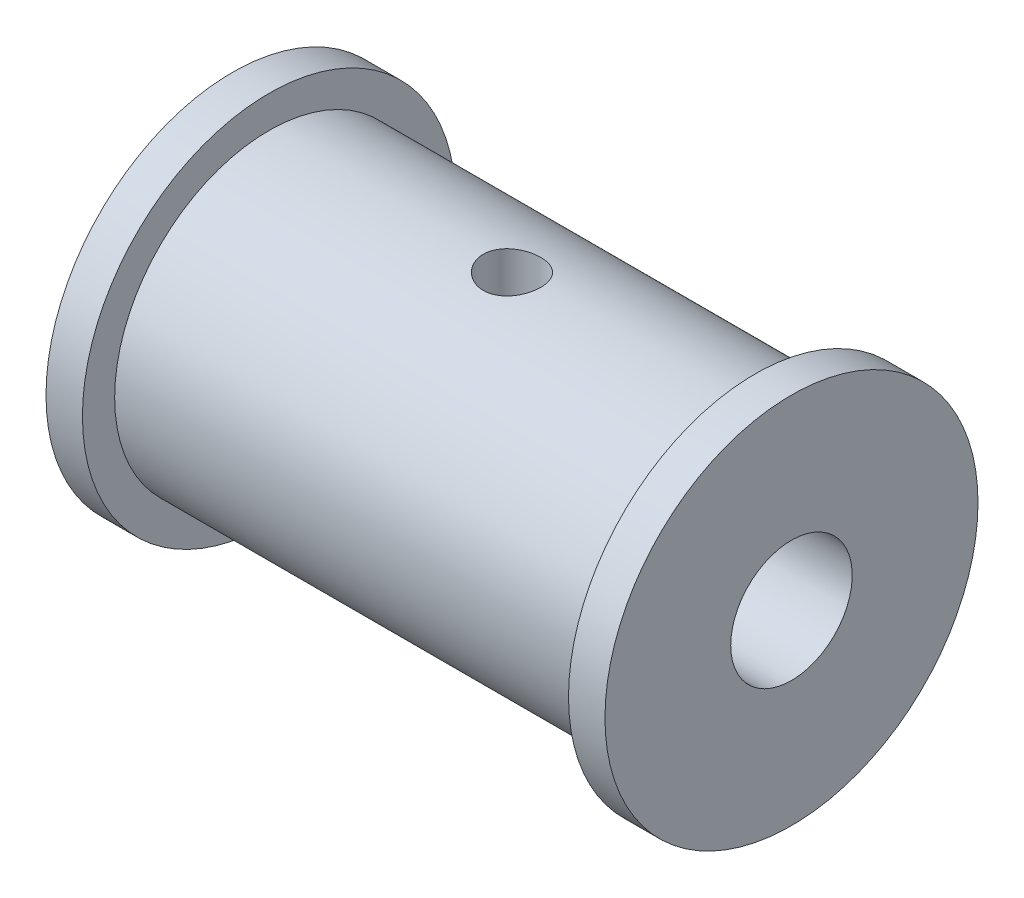
from build123d import *

# Parameters (mm, degrees)
SKETCH2_R          = 1.5
CUT_EXTRUDE1_DEPTH = 21.082922848


with BuildPart() as part:
    # Sketch1 → Revolve1 (revolve)
    with BuildSketch(Plane.XY):
        Polygon((14.605, 3.175), (14.605, 9.74725), (12.7, 9.74725), (12.7, 8.0645), (-12.7, 8.0645), (-12.7, 9.74725), (-14.605, 9.74725), (-14.605, 3.175), align=None)
    revolve(axis=Axis((-15.275524476, 0, 0), (1, 0, 0)))

    # Sketch2 → Cut-Extrude1 (cut, through all)
    with BuildSketch(Plane(origin=(0, 0, 0), x_dir=(1, 0, 0), z_dir=(0, 1, 0))):
        Circle(SKETCH2_R)
    extrude(amount=CUT_EXTRUDE1_DEPTH, mode=Mode.SUBTRACT)


solid = part.part
